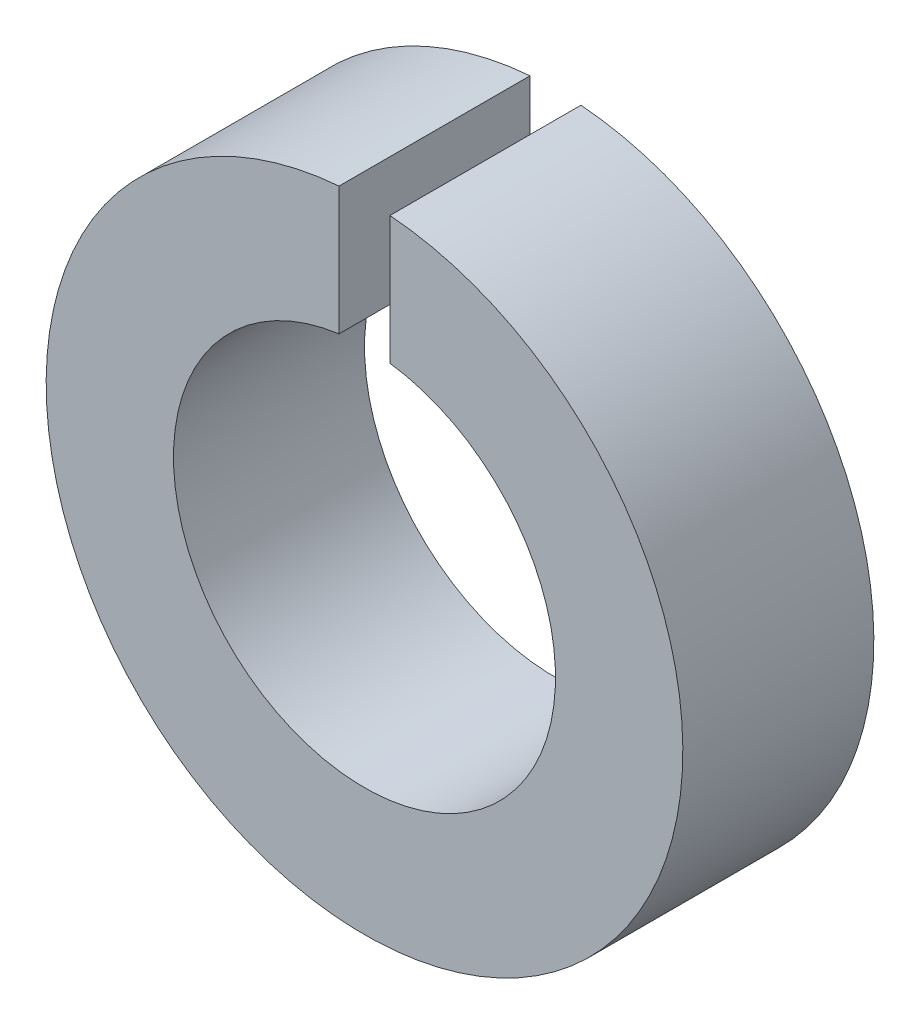
from build123d import *

# Parameters (mm, degrees)
BOSS_EXTRUDE2_DEPTH = 4.7625


with BuildPart() as part:
    # Sketch1 → Boss-Extrude2 (new, symmetric)
    with BuildSketch(Plane.XY):
        with BuildLine():
            Line((1.27, 9.439953655), (1.27, 15.824118459))
            ThreePointArc((1.27, 15.824118459), (0, -15.875), (-1.27, 15.824118459))
            Line((-1.27, 15.824118459), (-1.27, 9.439953655))
            ThreePointArc((-1.27, 9.439953655), (0, -9.525), (1.27, 9.439953655))
        make_face()
    extrude(amount=BOSS_EXTRUDE2_DEPTH, both=True)


solid = part.part
